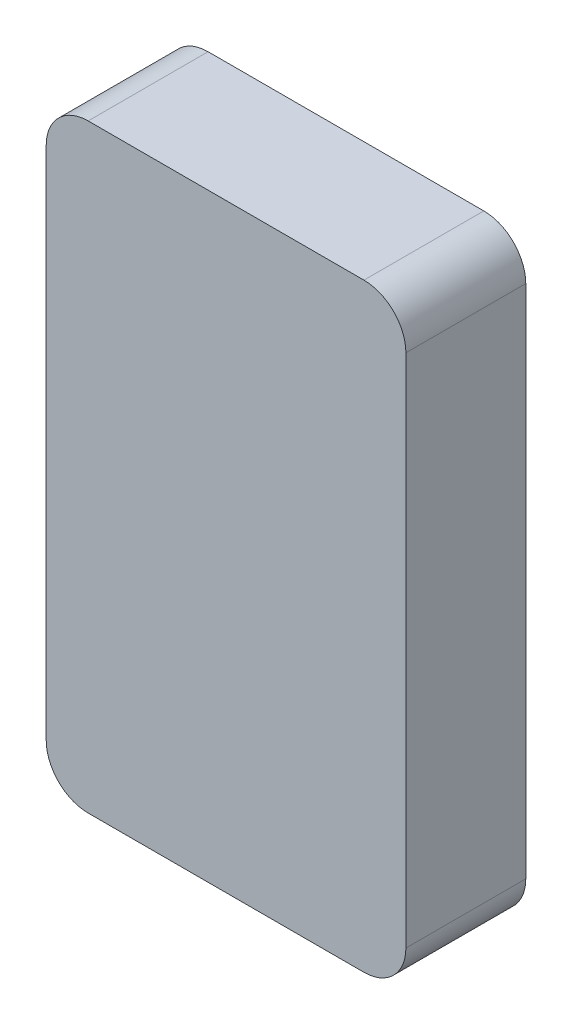
from build123d import *

# Parameters (mm, degrees)
SKETCH1_W           = 300
SKETCH1_H           = 500
BOSS_EXTRUDE1_DEPTH = 100
FILLET1_R           = 35


with BuildPart() as part:
    # Sketch1 → Boss-Extrude1 (new body)
    with BuildSketch(Plane.XY):
        Rectangle(SKETCH1_W, SKETCH1_H)
    extrude(amount=-BOSS_EXTRUDE1_DEPTH)

    # Fillet1
    fillet1_edges = [part.edges().sort_by_distance(p)[0] for p in [
        (150, -250, -50),
        (-150, -250, -50),
        (-150, 250, -50),
        (150, 250, -50),
    ]]
    fillet(fillet1_edges, radius=FILLET1_R)


solid = part.part
